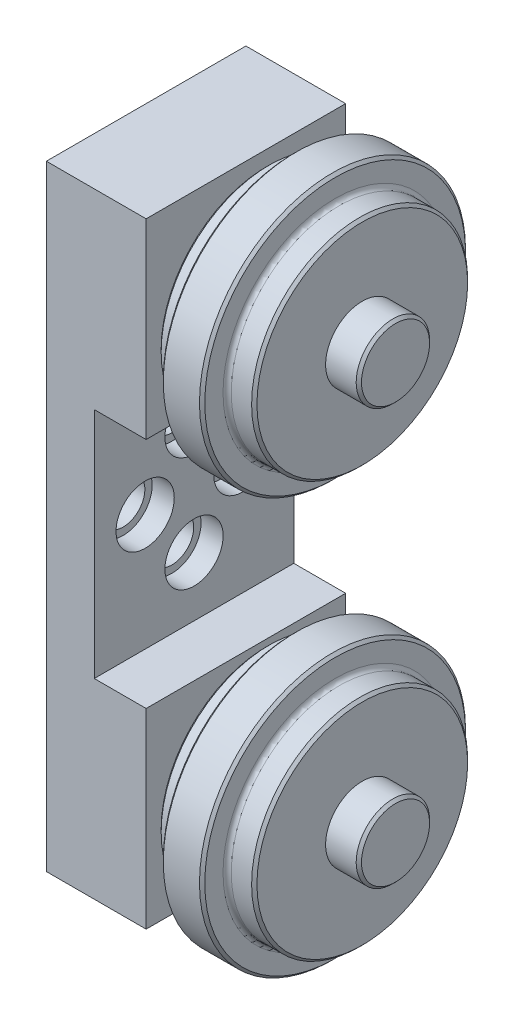
from build123d import *

# Parameters (mm, degrees)
BOSS_EXTRUDE1_DEPTH = 19.05
SKETCH3_R           = 3.9624
CUT_EXTRUDE1_DEPTH  = 85.555799808
SKETCH4_R           = 4.1656
CUT_EXTRUDE2_DEPTH  = 80.764215142
SKETCH5_R           = 5.5626
CUT_EXTRUDE3_DEPTH  = 4.2164


with BuildPart() as part:
    # Sketch2 → Revolve1 (revolve)
    with BuildSketch(Plane.XY, mode=Mode.PRIVATE) as revolve1_sk:
        with BuildLine():
            Line((3.9624, 61.0997), (3.9624, 64.5795))
            Line((3.9624, 64.5795), (3.4544, 65.0875))
            Line((3.4544, 65.0875), (-3.4544, 65.0875))
            Line((-3.4544, 65.0875), (-3.9624, 64.5795))
            Line((-3.9624, 64.5795), (-3.9624, 61.0997))
            ThreePointArc((-3.9624, 61.0997), (-4.19302412, 60.54292412), (-4.7498, 60.3123))
            Line((-4.7498, 60.3123), (-8.636, 60.3123))
            Line((-8.636, 60.3123), (-9.144, 59.8043))
            Line((-9.144, 59.8043), (-9.144, 43.6499))
            Line((-9.144, 43.6499), (-9.655025306, 43.6499))
            Line((-9.655025306, 43.6499), (-9.655025306, 49.2125))
            Line((-9.655025306, 49.2125), (-13.081, 49.2125))
            Line((-13.081, 49.2125), (-13.081, 43.6499))
            Line((-13.081, 43.6499), (-22.098, 43.6499))
            Line((-22.098, 43.6499), (-22.606, 43.1419))
            Line((-22.606, 43.1419), (-22.606, 39.6875))
            Line((-22.606, 39.6875), (15.494, 39.6875))
            Line((15.494, 39.6875), (15.494, 46.1899))
            Line((15.494, 46.1899), (14.986, 46.6979))
            Line((14.986, 46.6979), (9.144, 46.6979))
            Line((9.144, 46.6979), (9.144, 59.8043))
            Line((9.144, 59.8043), (8.636, 60.3123))
            Line((8.636, 60.3123), (4.7498, 60.3123))
            ThreePointArc((4.7498, 60.3123), (4.19302412, 60.54292412), (3.9624, 61.0997))
        make_face()
    revolve(revolve1_sk.sketch.rotate(Axis((-22.606, 39.6875, 0), (1, 0, 0)), 90), axis=Axis((-22.606, 39.6875, 0), (1, 0, 0)))


with BuildPart() as body_2:
    # Sketch1 → Boss-Extrude1 (new, symmetric)
    with BuildSketch(Plane.XY):
        Polygon((-32.131, 58.7375), (-32.131, -58.7375), (-13.081, -58.7375), (-13.081, -22.2377), (-22.987, -22.2377), (-22.987, 22.2377), (-13.081, 22.2377), (-13.081, 58.7375), align=None)
    extrude(amount=BOSS_EXTRUDE1_DEPTH, both=True)

    # Sketch3 → Cut-Extrude1 (cut, through all)
    with BuildSketch(Plane.ZY.offset(32.131)):
        with Locations((0, 39.6875)):
            Circle(SKETCH3_R)
        with Locations((0, -39.6875)):
            Circle(SKETCH3_R)
    extrude(amount=-CUT_EXTRUDE1_DEPTH, mode=Mode.SUBTRACT)

    # Sketch4 → Cut-Extrude2 (cut, through all)
    with BuildSketch(Plane(origin=(-22.987, 0, 0), x_dir=(0, 0, -1), z_dir=(1, 0, 0))):
        with Locations((0, 10.922)):
            Circle(SKETCH4_R)
        with Locations((0, -10.922)):
            Circle(SKETCH4_R)
        with Locations((-9.3345, 0)):
            Circle(SKETCH4_R)
        with Locations((9.3345, 0)):
            Circle(SKETCH4_R)
    extrude(amount=-CUT_EXTRUDE2_DEPTH, mode=Mode.SUBTRACT)

    # Sketch5 → Cut-Extrude3 (cut)
    with BuildSketch(Plane(origin=(-22.987, 0, 0), x_dir=(0, 0, -1), z_dir=(1, 0, 0))):
        with Locations((0, 10.922)):
            Circle(SKETCH5_R)
        with Locations((9.3345, 0)):
            Circle(SKETCH5_R)
        with Locations((-9.3345, 0)):
            Circle(SKETCH5_R)
        with Locations((0, -10.922)):
            Circle(SKETCH5_R)
    extrude(amount=-CUT_EXTRUDE3_DEPTH, mode=Mode.SUBTRACT)


with BuildPart() as body_3:
    # Mirror1: mirrored copy
    add(part.part.mirror(Plane.ZX))


solid = Compound([part.part, body_2.part, body_3.part])
